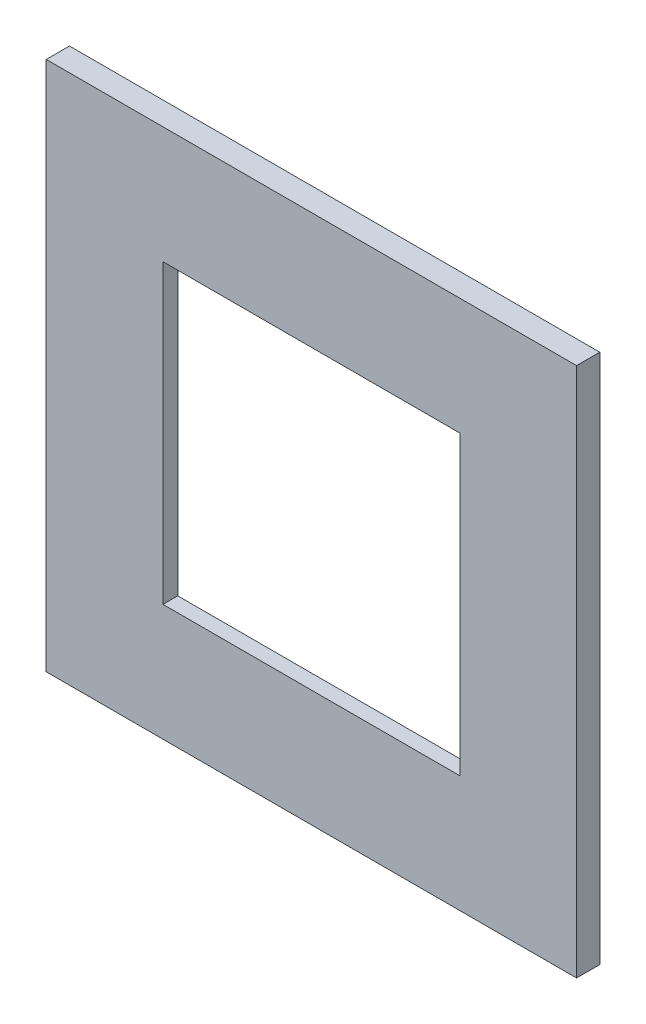
from build123d import *

# Parameters (mm, degrees)
SKETCH1_W           = 82.2
SKETCH1_H           = 3.6
BOSS_EXTRUDE1_DEPTH = 82.2
SKETCH2_W           = 76.4
SKETCH2_H           = 76.4
CUT_EXTRUDE1_DEPTH  = 1.31
SKETCH4_R           = 1
CUT_EXTRUDE3_DEPTH  = 1.31
SKETCH3_W           = 46
SKETCH3_H           = 46
CUT_EXTRUDE2_DEPTH  = 92.930920261


with BuildPart() as part:
    # Sketch1 → Boss-Extrude1 (new body)
    with BuildSketch(Plane(origin=(0, 0, 0), x_dir=(1, 0, 0), z_dir=(0, 1, 0))):
        with Locations((0, 1.8)):
            Rectangle(SKETCH1_W, SKETCH1_H)
    extrude(amount=BOSS_EXTRUDE1_DEPTH)

    # Sketch2 → Cut-Extrude1 (cut)
    with BuildSketch(Plane(origin=(0, 0, -3.6), x_dir=(-1, 0, 0), z_dir=(0, 0, -1))):
        with Locations((0, 41.1)):
            Rectangle(SKETCH2_W, SKETCH2_H)
    extrude(amount=-CUT_EXTRUDE1_DEPTH, mode=Mode.SUBTRACT)

    # Sketch4 → Cut-Extrude3 (cut)
    with BuildSketch(Plane(origin=(0, 0, -3.6), x_dir=(-1, 0, 0), z_dir=(0, 0, -1))):
        with Locations((38.2, 2.9)):
            Circle(SKETCH4_R)
        with Locations((38.2, 79.3)):
            Circle(SKETCH4_R)
        with Locations((-38.2, 2.9)):
            Circle(SKETCH4_R)
        with Locations((-38.2, 79.3)):
            Circle(SKETCH4_R)
    extrude(amount=-CUT_EXTRUDE3_DEPTH, mode=Mode.SUBTRACT)

    # Sketch3 → Cut-Extrude2 (cut, through all)
    with BuildSketch(Plane(origin=(0, 0, -2.29), x_dir=(-1, 0, 0), z_dir=(0, 0, -1))):
        with Locations((0, 41.1)):
            Rectangle(SKETCH3_W, SKETCH3_H)
    extrude(amount=-CUT_EXTRUDE2_DEPTH, mode=Mode.SUBTRACT)


solid = part.part
